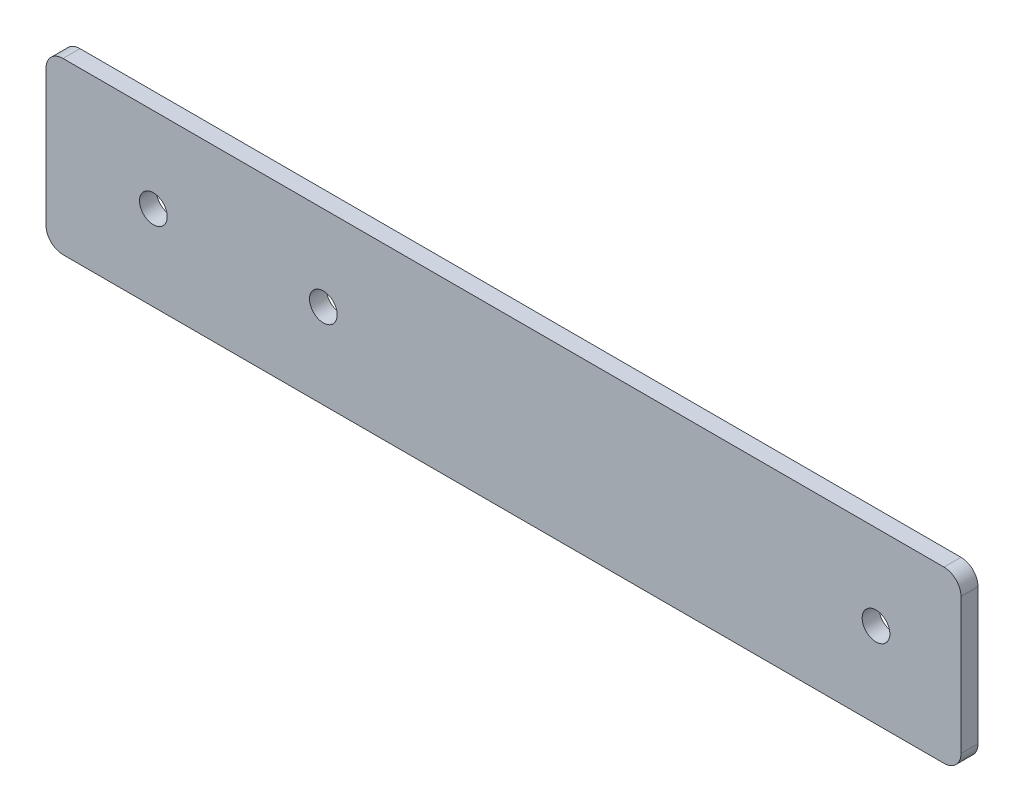
from build123d import *

# Parameters (mm, degrees)
SKETCH1_W           = 136.728026614
SKETCH1_H           = 25.4
SKETCH1_R           = 2.0701
BOSS_EXTRUDE1_DEPTH = 2.54
FILLET1_R           = 2.54


with BuildPart() as part:
    # Sketch1 → Boss-Extrude1 (new body)
    with BuildSketch(Plane.XY):
        with Locations((-50.574385066, 189.601133889)):
            Rectangle(SKETCH1_W, SKETCH1_H)
        with Locations((5.089617917, 189.601133889)):
            Circle(SKETCH1_R, mode=Mode.SUBTRACT)
        with Locations((-77.492939904, 189.601134208)):
            Circle(SKETCH1_R, mode=Mode.SUBTRACT)
        with Locations((-102.892939904, 189.601134208)):
            Circle(SKETCH1_R, mode=Mode.SUBTRACT)
    extrude(amount=BOSS_EXTRUDE1_DEPTH)

    # Fillet1
    fillet1_edges = [part.edges().sort_by_distance(p)[0] for p in [
        (17.789628241, 202.301133889, 1.27),
        (17.789628241, 176.901133889, 1.27),
        (-118.938398373, 176.901133889, 1.27),
        (-118.938398373, 202.301133889, 1.27),
    ]]
    fillet(fillet1_edges, radius=FILLET1_R)


solid = part.part
